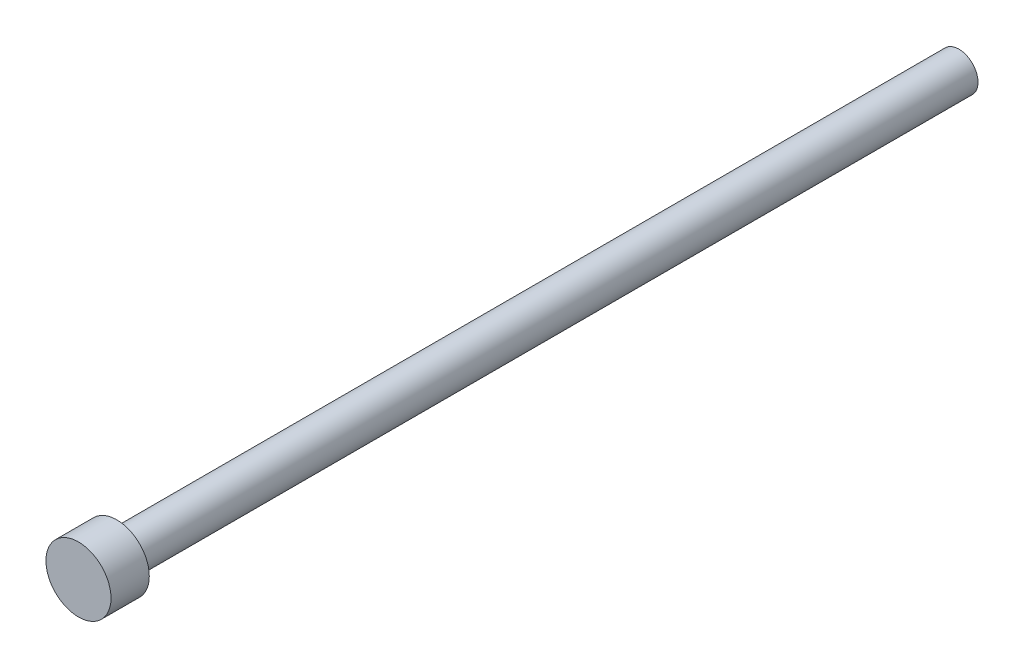
from build123d import *

# Parameters (mm, degrees)
SKETCH1_R           = 2.5
BOSS_EXTRUDE1_DEPTH = 110
SKETCH2_R           = 4.25
BOSS_EXTRUDE2_DEPTH = 5


with BuildPart() as part:
    # Sketch1 → Boss-Extrude1 (new body)
    with BuildSketch(Plane.XY):
        Circle(SKETCH1_R)
    extrude(amount=BOSS_EXTRUDE1_DEPTH)

    # Sketch2 → Boss-Extrude2 (add)
    with BuildSketch(Plane.XY.offset(110)):
        Circle(SKETCH2_R)
    extrude(amount=BOSS_EXTRUDE2_DEPTH)


solid = part.part
